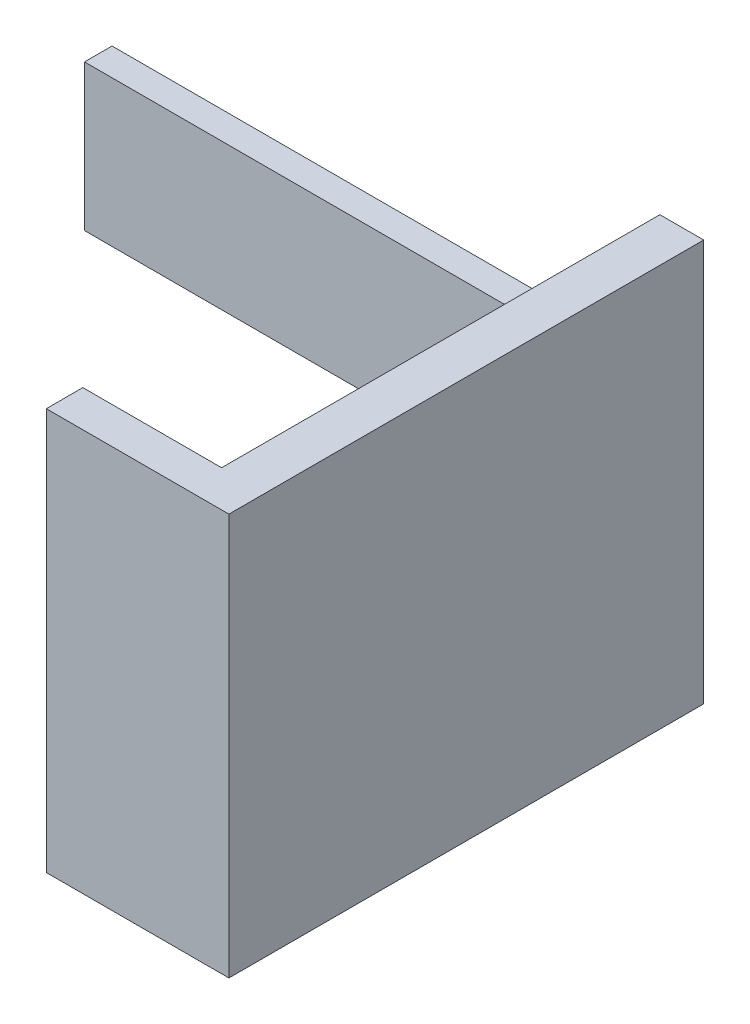
from build123d import *

# Parameters (mm, degrees)
SKETCH1_W           = 50
SKETCH1_H           = 110
BOSS_EXTRUDE1_DEPTH = 10
SKETCH2_W           = 12
SKETCH2_H           = 110
BOSS_EXTRUDE2_DEPTH = 120
SKETCH3_W           = 7.539466006
SKETCH3_H           = 40
BOSS_EXTRUDE3_DEPTH = 150


with BuildPart() as part:
    # Sketch1 → Boss-Extrude1 (new body)
    with BuildSketch(Plane.XY):
        with Locations((-25, 55)):
            Rectangle(SKETCH1_W, SKETCH1_H)
    extrude(amount=BOSS_EXTRUDE1_DEPTH)

    # Sketch2 → Boss-Extrude2 (add)
    with BuildSketch(Plane(origin=(0, 0, 0), x_dir=(-1, 0, 0), z_dir=(0, 0, -1))):
        with Locations((6, 55)):
            Rectangle(SKETCH2_W, SKETCH2_H)
    extrude(amount=BOSS_EXTRUDE2_DEPTH)

    # Sketch3 → Boss-Extrude3 (add)
    with BuildSketch(Plane.ZY.offset(12)):
        with Locations((-116.230266997, 55)):
            Rectangle(SKETCH3_W, SKETCH3_H)
    extrude(amount=BOSS_EXTRUDE3_DEPTH)


solid = part.part
